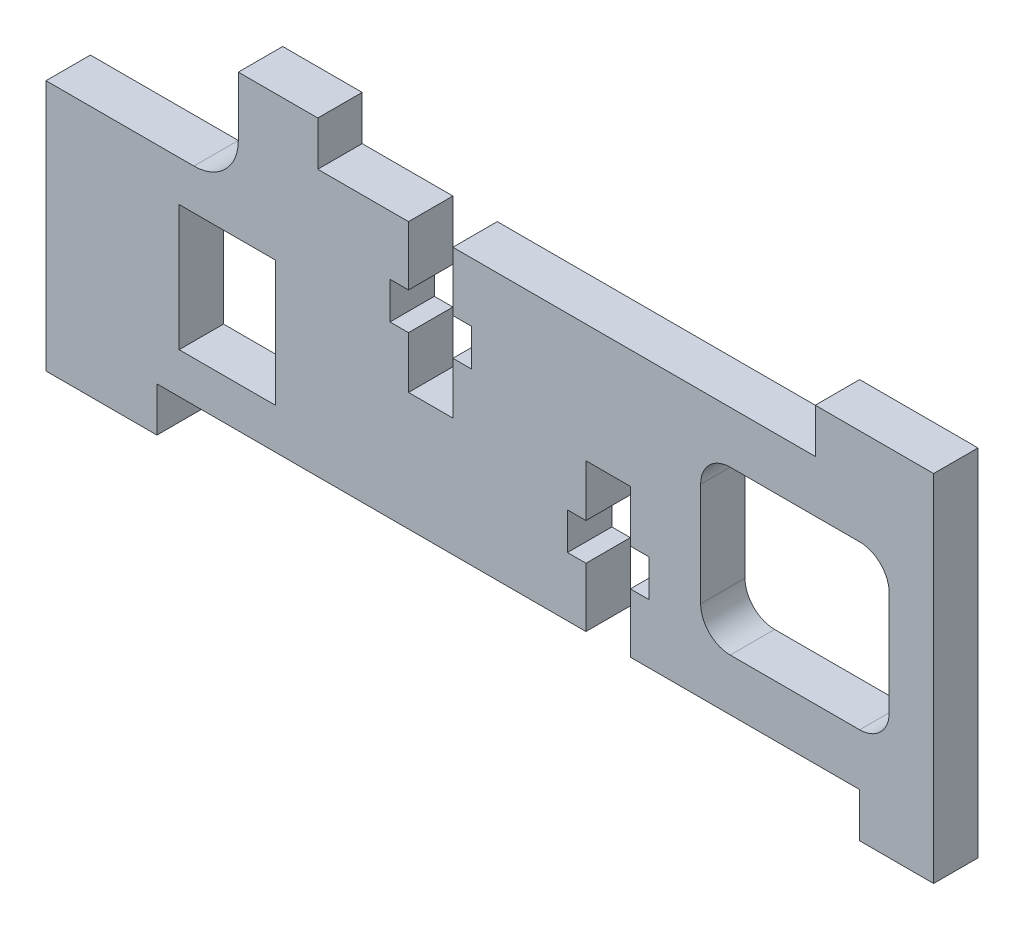
from build123d import *

# Parameters (mm, degrees)
SKETCH_1_W      = 6.5
SKETCH_1_H      = 8.5
EXTRUDE_1_DEPTH = 3


with BuildPart() as part:
    # 草图1 → 凸台-拉伸1 (new body)
    with BuildSketch(Plane.XY.offset(3)):
        with BuildLine():
            Line((7.4994, -8.416368207), (36.5002, -8.416368207))
            Line((36.5002, -8.416368207), (36.5002, -4.416368207))
            Line((36.5002, -4.416368207), (35.2489, -4.416368207))
            Line((35.2489, -4.416368207), (35.2489, -1.916368207))
            Line((35.2489, -1.916368207), (36.5002, -1.916368207))
            Line((36.5002, -1.916368207), (36.5002, 1.583631793))
            Line((36.5002, 1.583631793), (39.5003, 1.583631793))
            Line((39.5003, 1.583631793), (39.5003, -1.916368207))
            Line((39.5003, -1.916368207), (40.7501, -1.916368207))
            Line((40.7501, -1.916368207), (40.7501, -4.416368207))
            Line((40.7501, -4.416368207), (39.5003, -4.416368207))
            Line((39.5003, -4.416368207), (39.5003, -8.416368207))
            Line((39.5003, -8.416368207), (54.9988, -8.416368207))
            Line((54.9988, -8.416368207), (54.9988, -11.416368207))
            Line((54.9988, -11.416368207), (59.9998, -11.416368207))
            Line((59.9998, -11.416368207), (59.9998, 12.583631793))
            Line((59.9998, 12.583631793), (51.9988, 12.583631793))
            Line((51.9988, 12.583631793), (51.9988, 9.583631793))
            Line((51.9988, 9.583631793), (27.5031, 9.583631793))
            Line((27.5031, 9.583631793), (27.5031, 5.583631793))
            Line((27.5031, 5.583631793), (28.7543, 5.583631793))
            Line((28.7543, 5.583631793), (28.7543, 3.083631793))
            Line((28.7543, 3.083631793), (27.5031, 3.083631793))
            Line((27.5031, 3.083631793), (27.5031, -0.416368207))
            Line((27.5031, -0.416368207), (24.503, -0.416368207))
            Line((24.503, -0.416368207), (24.503, 3.083631793))
            Line((24.503, 3.083631793), (23.2531, 3.083631793))
            Line((23.2531, 3.083631793), (23.2531, 5.583631793))
            Line((23.2531, 5.583631793), (24.503, 5.583631793))
            Line((24.503, 5.583631793), (24.503, 9.583631793))
            Line((24.503, 9.583631793), (18.3721, 9.583631793))
            Line((18.3721, 9.583631793), (18.3721, 12.583631793))
            Line((18.3721, 12.583631793), (12.9991, 12.583631793))
            Line((12.9991, 12.583631793), (12.9991, 8.582631793))
            ThreePointArc((12.9991, 8.582631793), (12.120420344, 6.461311449), (9.9991, 5.582631793))
            Line((9.9991, 5.582631793), (0, 5.582631793))
            Line((0, 5.582631793), (0, -11.416368207))
            Line((0, -11.416368207), (7.4994, -11.416368207))
            Line((7.4994, -11.416368207), (7.4994, -8.416368207))
        make_face()
        with Locations((12.25, -1.416368207)):
            Rectangle(SKETCH_1_W, SKETCH_1_H, mode=Mode.SUBTRACT)
        with BuildLine():
            Line((56.9998, 4.082631793), (56.9998, -2.916368207))
            ThreePointArc((56.9998, -2.916368207), (56.414013562, -4.330581769), (54.9998, -4.916368207))
            Line((54.9998, -4.916368207), (46.2504, -4.916368207))
            ThreePointArc((46.2504, -4.916368207), (44.836186438, -4.330581769), (44.2504, -2.916368207))
            Line((44.2504, -2.916368207), (44.2504, 4.082631793))
            ThreePointArc((44.2504, 4.082631793), (44.836186438, 5.496845355), (46.2504, 6.082631793))
            Line((46.2504, 6.082631793), (54.9998, 6.082631793))
            ThreePointArc((54.9998, 6.082631793), (56.414013562, 5.496845355), (56.9998, 4.082631793))
        make_face(mode=Mode.SUBTRACT)
    extrude(amount=-EXTRUDE_1_DEPTH)


solid = part.part
